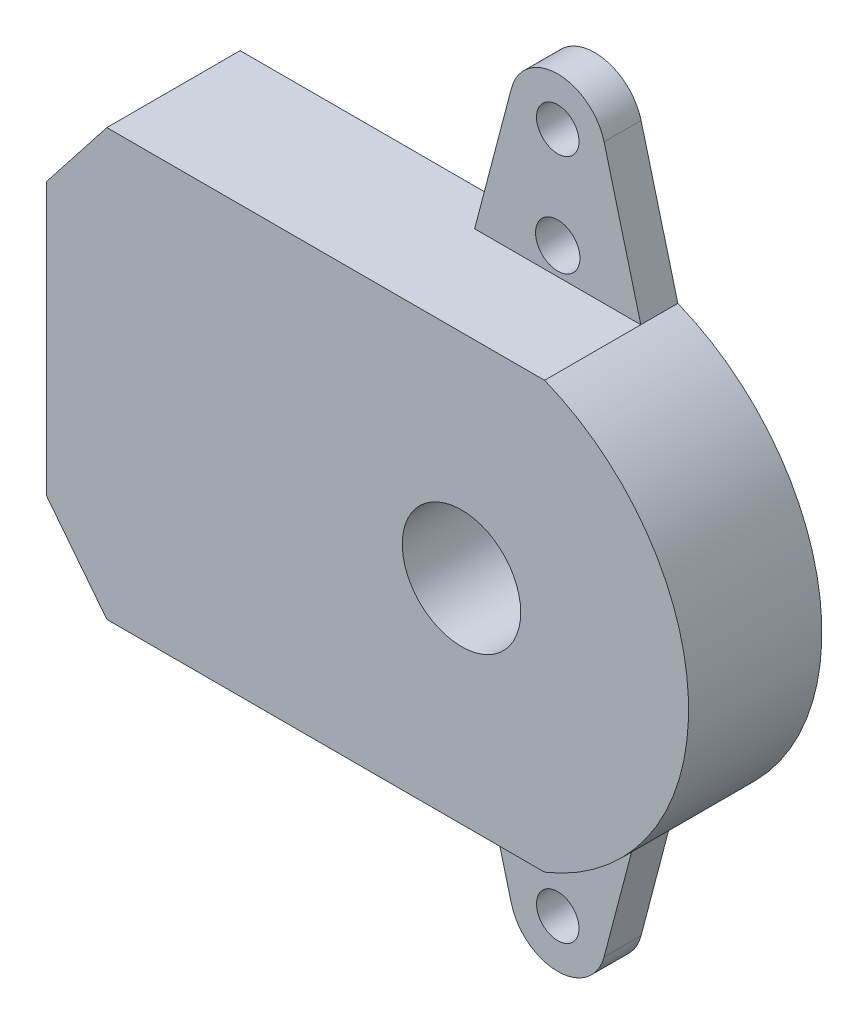
from build123d import *

# Parameters (mm, degrees)
ESQUISSE1_R             = 1.435
ESQUISSE1_R_2           = 1.5
BOSS_EXTRU_2_DEPTH      = 2.5
BOSS_EXTRU_3_DEPTH      = 6.5
ESQUISSE3_R             = 4
ENL_V_MAT_EXTRU_1_DEPTH = 10


with BuildPart() as part:
    # Esquisse1 → Boss.-Extru.2 (new body)
    with BuildSketch(Plane.XY):
        with BuildLine():
            Line((22.427498376, 0), (24.908638492, -9.449680852))
            ThreePointArc((24.908638492, -9.449680852), (28.04, -11.865), (31.171361508, -9.449680852))
            Line((31.171361508, -9.449680852), (33.652501624, 0))
            ThreePointArc((33.652501624, 0), (43.38, 14.385), (33.652501624, 28.77))
            Line((33.652501624, 28.77), (31.171361508, 38.219680852))
            ThreePointArc((31.171361508, 38.219680852), (28.04, 40.635), (24.908638492, 38.219680852))
            Line((24.908638492, 38.219680852), (22.427498376, 28.77))
            Line((22.427498376, 28.77), (4.087498376, 28.77))
            Line((4.087498376, 28.77), (0, 23.555))
            Line((0, 23.555), (0, 5.215))
            Line((0, 5.215), (4.087498376, 0))
            Line((4.087498376, 0), (22.427498376, 0))
        make_face()
        with Locations((28.04, 37.3975)):
            Circle(ESQUISSE1_R, mode=Mode.SUBTRACT)
        with Locations((28.04, -8.6275)):
            Circle(ESQUISSE1_R, mode=Mode.SUBTRACT)
        with Locations((28.04, 30.6)):
            Circle(ESQUISSE1_R_2, mode=Mode.SUBTRACT)
        with Locations((28.04, -1.83)):
            Circle(ESQUISSE1_R_2, mode=Mode.SUBTRACT)
    extrude(amount=BOSS_EXTRU_2_DEPTH)

    # Esquisse2 → Boss.-Extru.3 (add)
    with BuildSketch(Plane.XY.offset(2.5)):
        with BuildLine():
            Line((4.087498376, 28.77), (33.652501624, 28.77))
            ThreePointArc((33.652501624, 28.77), (43.38, 14.385), (33.652501624, 0))
            Line((33.652501624, 0), (4.087498376, 0))
            Line((4.087498376, 0), (0, 5.215))
            Line((0, 5.215), (0, 23.555))
            Line((0, 23.555), (4.087498376, 28.77))
        make_face()
    extrude(amount=BOSS_EXTRU_3_DEPTH)

    # Esquisse3 → Enlèv. mat.-Extru.1 (cut)
    with BuildSketch(Plane.XY.offset(9)):
        with Locations((28.04, 14.385)):
            Circle(ESQUISSE3_R)
    extrude(amount=-ENL_V_MAT_EXTRU_1_DEPTH, mode=Mode.SUBTRACT)


solid = part.part
